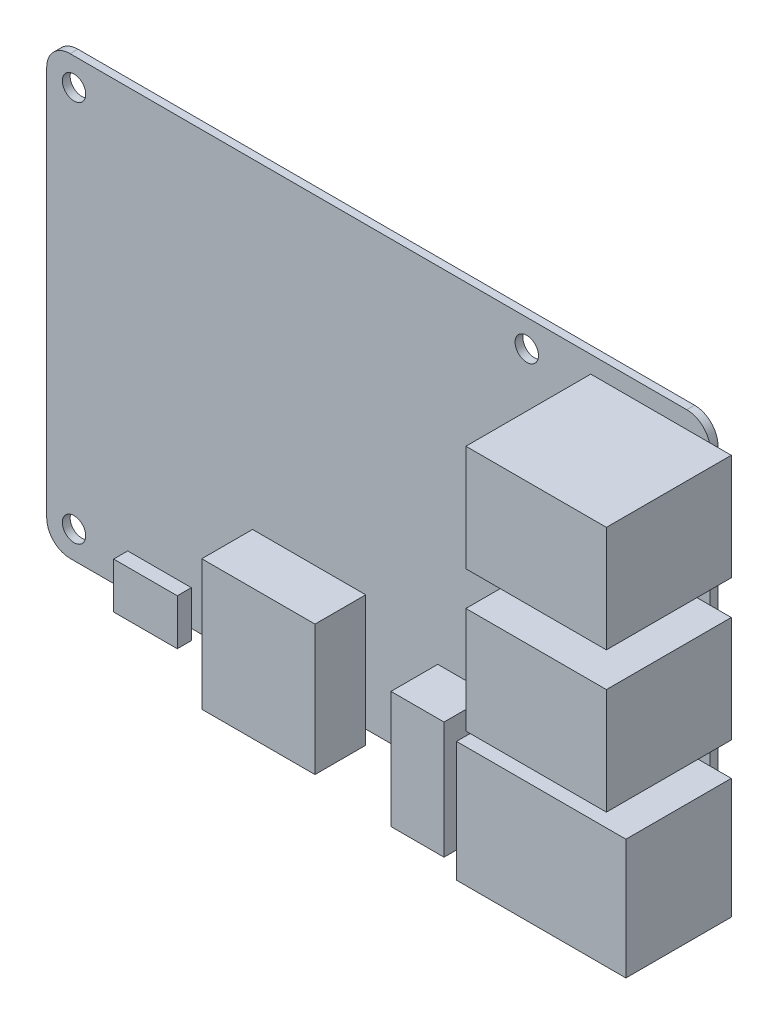
from build123d import *

# Parameters (mm, degrees)
ESQUISSE1_W                = 85
ESQUISSE1_H                = 56
BOSS_EXTRU_1_DEPTH         = 1
CONG_3_R                   = 3
CONG_4_R                   = 3
CONG_5_R                   = 3
CONG_6_R                   = 3
ESQUISSE2_R                = 1.5
ENL_V_MAT_EXTRU_1_DEPTH    = 55.498557908
ESQUISSE3_W                = 15.3
ESQUISSE3_H                = 13.6
BOSS_EXTRU_3_DEPTH         = 16
ESQUISSE5_W                = 16
ESQUISSE5_H                = 13.6
BOSS_EXTRU_4_DEPTH         = 2.7
R_P_TITION_LIN_AIRE1_COUNT = 2
R_P_TITION_LIN_AIRE1_PITCH = 18
R_P_TITION_LIN_AIRE2_COUNT = 2
R_P_TITION_LIN_AIRE2_PITCH = 18
ESQUISSE7_W                = 21.7
ESQUISSE7_H                = 15.4
BOSS_EXTRU_5_DEPTH         = 13.5
ESQUISSE8_W                = 6.8
ESQUISSE8_H                = 15
BOSS_EXTRU_6_DEPTH         = 6
ESQUISSE9_W                = 14.5
ESQUISSE9_H                = 16.7
BOSS_EXTRU_7_DEPTH         = 6.5
ESQUISSE10_W               = 8.15
ESQUISSE10_H               = 5.88
BOSS_EXTRU_8_DEPTH         = 1.8


with BuildPart() as part:
    # Esquisse1 → Boss.-Extru.1 (new body)
    with BuildSketch(Plane.XY):
        with Locations((-1.608108108, -3.993243243)):
            Rectangle(ESQUISSE1_W, ESQUISSE1_H)
    extrude(amount=BOSS_EXTRU_1_DEPTH)

    # Congé3
    cong_3_edges = [part.edges().sort_by_distance(p)[0] for p in [
        (40.891891892, 24.006756757, 0.5),
    ]]
    fillet(cong_3_edges, radius=CONG_3_R)

    # Congé4
    cong_4_edges = [part.edges().sort_by_distance(p)[0] for p in [
        (-44.108108108, 24.006756757, 0.5),
    ]]
    fillet(cong_4_edges, radius=CONG_4_R)

    # Congé5
    cong_5_edges = [part.edges().sort_by_distance(p)[0] for p in [
        (-44.108108108, -31.993243243, 0.5),
    ]]
    fillet(cong_5_edges, radius=CONG_5_R)

    # Congé6
    cong_6_edges = [part.edges().sort_by_distance(p)[0] for p in [
        (40.891891892, -31.993243243, 0.5),
    ]]
    fillet(cong_6_edges, radius=CONG_6_R)

    # Esquisse2 → Enlèv. mat.-Extru.1 (cut, through all)
    with BuildSketch(Plane.XY.offset(1)):
        with Locations((-40.608108108, 20.506756757)):
            Circle(ESQUISSE2_R)
        with Locations((-40.608108108, -28.493243243)):
            Circle(ESQUISSE2_R)
        with Locations((17.391891892, -28.493243243)):
            Circle(ESQUISSE2_R)
        with Locations((17.391891892, 20.506756757)):
            Circle(ESQUISSE2_R)
    extrude(amount=-ENL_V_MAT_EXTRU_1_DEPTH, mode=Mode.SUBTRACT)

    # Esquisse3 → Boss.-Extru.3 (add)
    with BuildSketch(Plane.XY.offset(1)):
        with Locations((33.241891892, 15.006756757)):
            Rectangle(ESQUISSE3_W, ESQUISSE3_H)
    boss_extru_3 = extrude(amount=BOSS_EXTRU_3_DEPTH)

    # Esquisse5 → Boss.-Extru.4 (add)
    with BuildSketch(Plane(origin=(40.891891892, 0, 0), x_dir=(0, 0, -1), z_dir=(1, 0, 0))):
        with Locations((-9, 15.006756757)):
            Rectangle(ESQUISSE5_W, ESQUISSE5_H)
    boss_extru_4 = extrude(amount=BOSS_EXTRU_4_DEPTH)

    # Répétition linéaire1: Boss.-Extru.3 ×2
    with Locations(*[(0, -i * R_P_TITION_LIN_AIRE1_PITCH, 0) for i in range(1, R_P_TITION_LIN_AIRE1_COUNT)]):
        add(boss_extru_3)

    # Répétition linéaire2: Boss.-Extru.4 ×2
    with Locations(*[(0, -i * R_P_TITION_LIN_AIRE2_PITCH, 0) for i in range(1, R_P_TITION_LIN_AIRE2_COUNT)]):
        add(boss_extru_4)

    # Esquisse7 → Boss.-Extru.5 (add)
    with BuildSketch(Plane.XY.offset(1)):
        with Locations((32.741891892, -21.743243243)):
            Rectangle(ESQUISSE7_W, ESQUISSE7_H)
    extrude(amount=BOSS_EXTRU_5_DEPTH)

    # Esquisse8 → Boss.-Extru.6 (add)
    with BuildSketch(Plane.XY.offset(1)):
        with Locations((9.391891892, -27.693243243)):
            Rectangle(ESQUISSE8_W, ESQUISSE8_H)
    extrude(amount=BOSS_EXTRU_6_DEPTH)

    # Esquisse9 → Boss.-Extru.7 (add)
    with BuildSketch(Plane.XY.offset(1)):
        with Locations((-10.491721189, -25.443243243)):
            Rectangle(ESQUISSE9_W, ESQUISSE9_H)
    extrude(amount=BOSS_EXTRU_7_DEPTH)

    # Esquisse10 → Boss.-Extru.8 (add)
    with BuildSketch(Plane.XY.offset(1)):
        with Locations((-29.658093883, -30.413243243)):
            Rectangle(ESQUISSE10_W, ESQUISSE10_H)
    extrude(amount=BOSS_EXTRU_8_DEPTH)


solid = part.part
